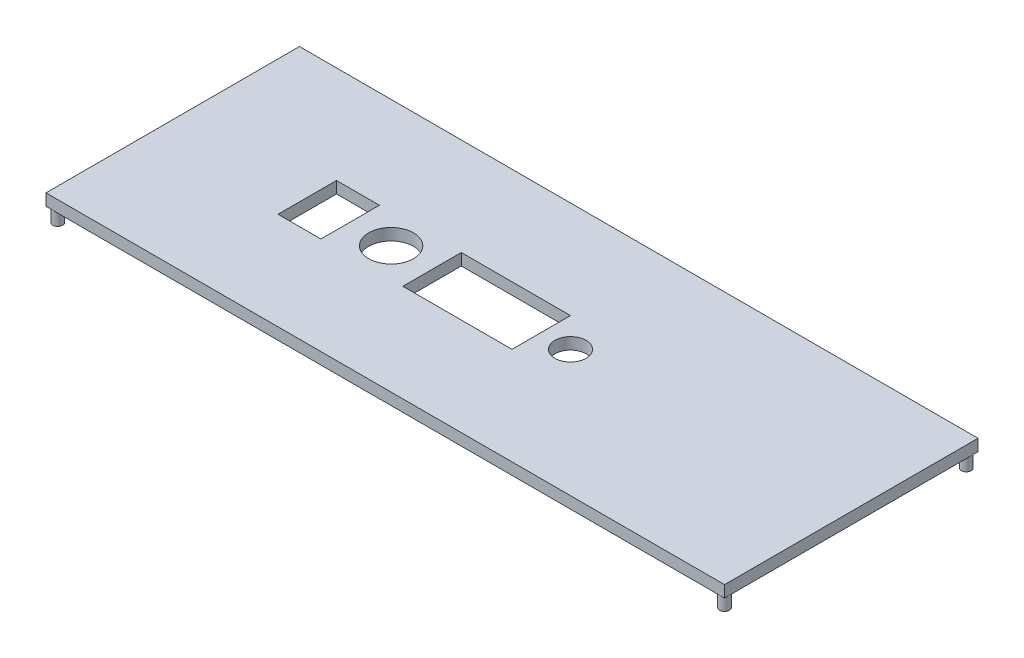
from build123d import *

# Parameters (mm, degrees)
SKETCH1_W            = 174
SKETCH1_H            = 65
BOSS_EXTRUDE1_DEPTH  = 3
SKETCH2_R            = 4
SKETCH2_R_2          = 5.75
SKETCH2_W            = 28
SKETCH2_H            = 15
SKETCH2_W_2          = 11
CUT_EXTRUDE1_DEPTH   = 3
SKETCH3_R            = 1.25
BOSS_EXTRUDE2_DEPTH  = 3.5
LPATTERN1_COUNT      = 2
LPATTERN1_PITCH      = 171
LPATTERN1_COUNT_DIR2 = 2
LPATTERN1_PITCH_DIR2 = 62


with BuildPart() as part:
    # Sketch1 → Boss-Extrude1 (new body)
    with BuildSketch(Plane(origin=(0, 0, 0), x_dir=(1, 0, 0), z_dir=(0, 1, 0))):
        with Locations((22.975352113, 1.809859155)):
            Rectangle(SKETCH1_W, SKETCH1_H)
    extrude(amount=BOSS_EXTRUDE1_DEPTH)

    # Sketch2 → Cut-Extrude1 (cut)
    with BuildSketch(Plane(origin=(0, 3, 0), x_dir=(1, 0, 0), z_dir=(0, 1, 0))):
        with Locations(Location((37.975352113, 1.809859155, 0), (0, 0, 270))):
            Circle(SKETCH2_R)
        with Locations(Location((-8.024647887, 1.809859155, 0), (0, 0, 270))):
            Circle(SKETCH2_R_2)
        with Locations((16.475352113, 1.809859155)):
            Rectangle(SKETCH2_W, SKETCH2_H)
        with Locations((-24.024647887, 1.809859155)):
            Rectangle(SKETCH2_W_2, SKETCH2_H)
    extrude(amount=-CUT_EXTRUDE1_DEPTH, mode=Mode.SUBTRACT)

    # Sketch3 → Boss-Extrude2 (add)
    with BuildSketch(Plane.XZ):
        with Locations(Location((-62.434647887, -32.719859155, 0), (0, 0, 90))):
            Circle(SKETCH3_R)
    boss_extrude2 = extrude(amount=BOSS_EXTRUDE2_DEPTH)

    # LPattern1: Boss-Extrude2 2 × 2
    with Locations(*[(i * LPATTERN1_PITCH, 0, j * LPATTERN1_PITCH_DIR2) for i in range(LPATTERN1_COUNT) for j in range(LPATTERN1_COUNT_DIR2) if (i, j) != (0, 0)]):
        add(boss_extrude2)


solid = part.part
